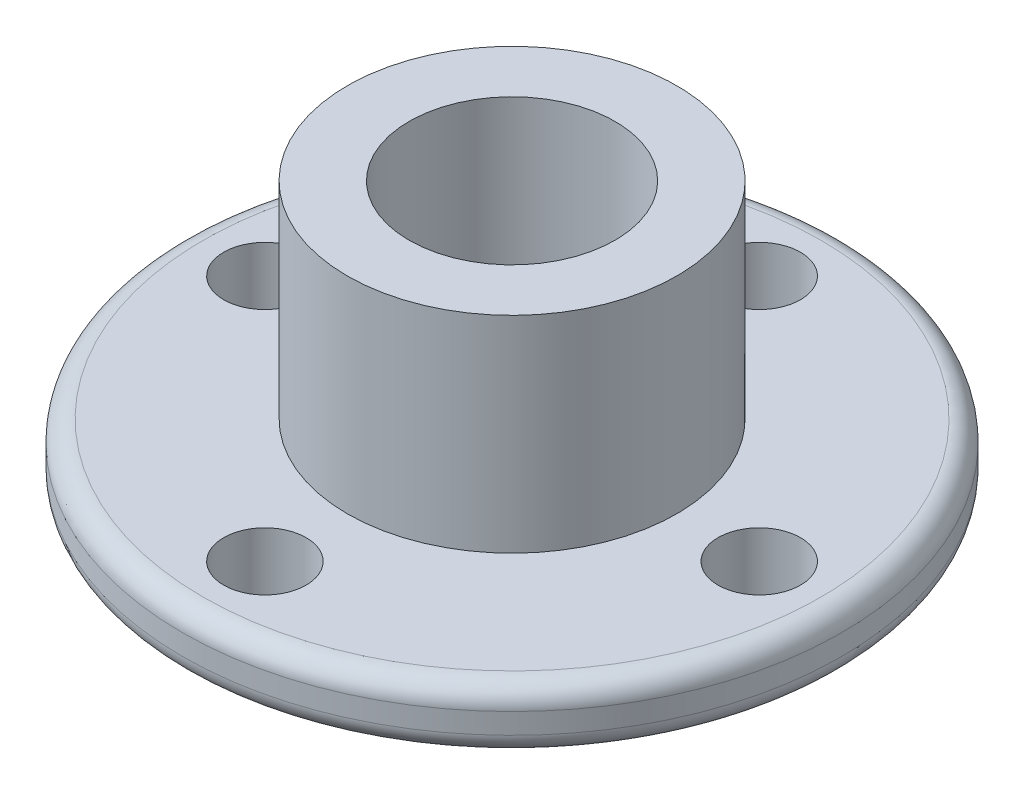
from build123d import *

# Parameters (mm, degrees)
SKETCH_1_R          = 16
EXTRUDE_1_DEPTH     = 3
SKETCH_2_R          = 2
SKETCH_2_R_2        = 5
CUT_EXTRUDE_1_DEPTH = 3
EXTRUDE_START       = 10
SKETCH_4_R          = 8
SKETCH_4_R_2        = 5
EXTRUDE_2_DEPTH     = 10
FILLET_1_R          = 1


with BuildPart() as part:
    # ｽｹｯﾁ1 → ﾎﾞｽ - 押し出し1 (new body)
    with BuildSketch(Plane(origin=(0, 0, 0), x_dir=(1, 0, 0), z_dir=(0, 1, 0))):
        with Locations(Location((0, 0, 0), (0, 0, 270))):
            Circle(SKETCH_1_R)
    extrude(amount=EXTRUDE_1_DEPTH)

    # ｽｹｯﾁ2 → ｶｯﾄ - 押し出し1 (cut)
    with BuildSketch(Plane(origin=(0, 3, 0), x_dir=(1, 0, 0), z_dir=(0, 1, 0))):
        with Locations(Location((0, 12, 0), (0, 0, 270))):
            Circle(SKETCH_2_R)
        with Locations(Location((12, 0, 0), (0, 0, 270))):
            Circle(SKETCH_2_R)
        with Locations(Location((0, -12, 0), (0, 0, 270))):
            Circle(SKETCH_2_R)
        with Locations(Location((-12, 0, 0), (0, 0, 270))):
            Circle(SKETCH_2_R)
        with Locations(Location((0, 0, 0), (0, 0, 270))):
            Circle(SKETCH_2_R_2)
    extrude(amount=-CUT_EXTRUDE_1_DEPTH, mode=Mode.SUBTRACT)

    # ｽｹｯﾁ4 → ﾎﾞｽ - 押し出し2 (add)
    with BuildSketch(Plane(origin=(0, 3, 0), x_dir=(1, 0, 0), z_dir=(0, 1, 0)).offset(EXTRUDE_START)):
        with Locations(Location((0, 0, 0), (0, 0, 270))):
            Circle(SKETCH_4_R)
        with Locations(Location((0, 0, 0), (0, 0, 270))):
            Circle(SKETCH_4_R_2, mode=Mode.SUBTRACT)
    extrude(amount=-EXTRUDE_2_DEPTH)

    # ﾌｨﾚｯﾄ1
    fillet_1_edges = [part.edges().sort_by_distance(p)[0] for p in [
        (0, 0, -16),
        (0, 3, -16),
    ]]
    fillet(fillet_1_edges, radius=FILLET_1_R)


solid = part.part
